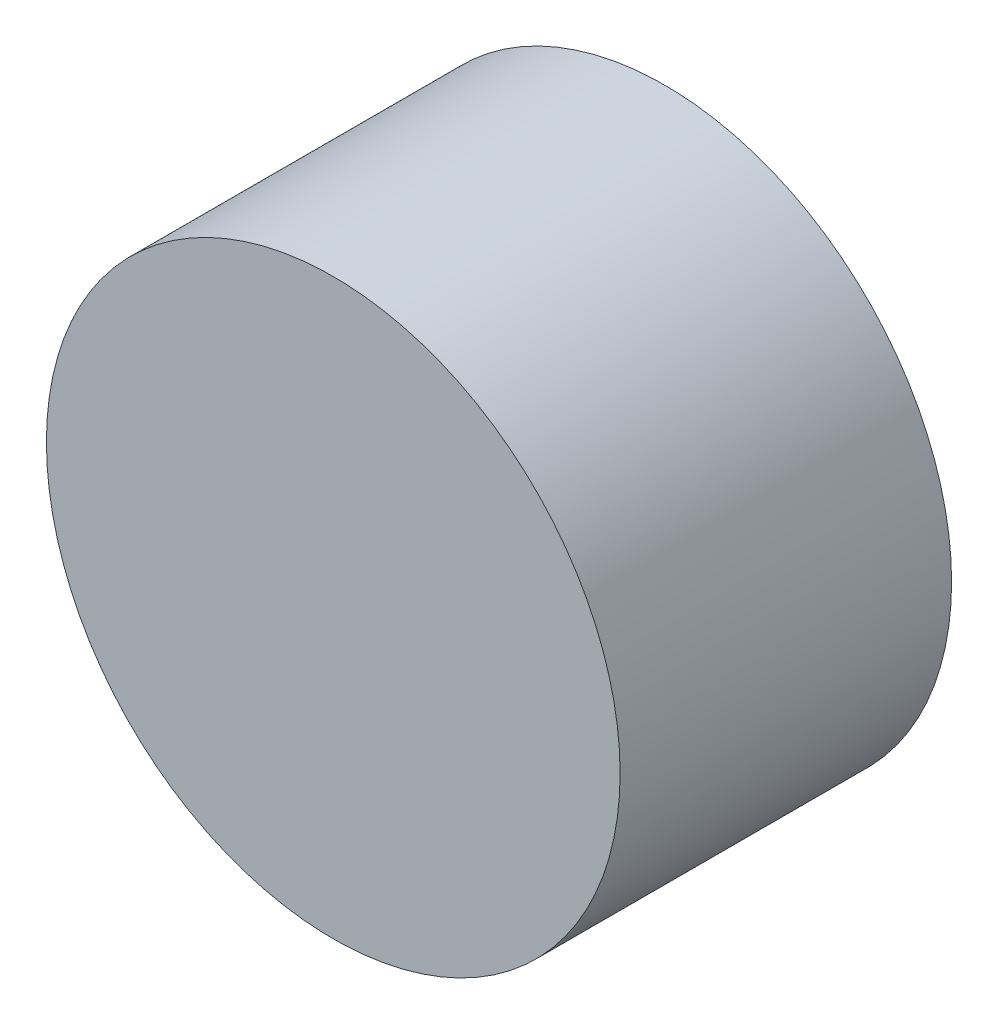
from build123d import *

# Parameters (mm, degrees)
SKETCH_1_R      = 225
EXTRUDE_1_DEPTH = 260


with BuildPart() as part:
    # 草图1 → 凸台-拉伸1 (new body)
    with BuildSketch(Plane.XY):
        Circle(SKETCH_1_R)
    extrude(amount=EXTRUDE_1_DEPTH)


solid = part.part
